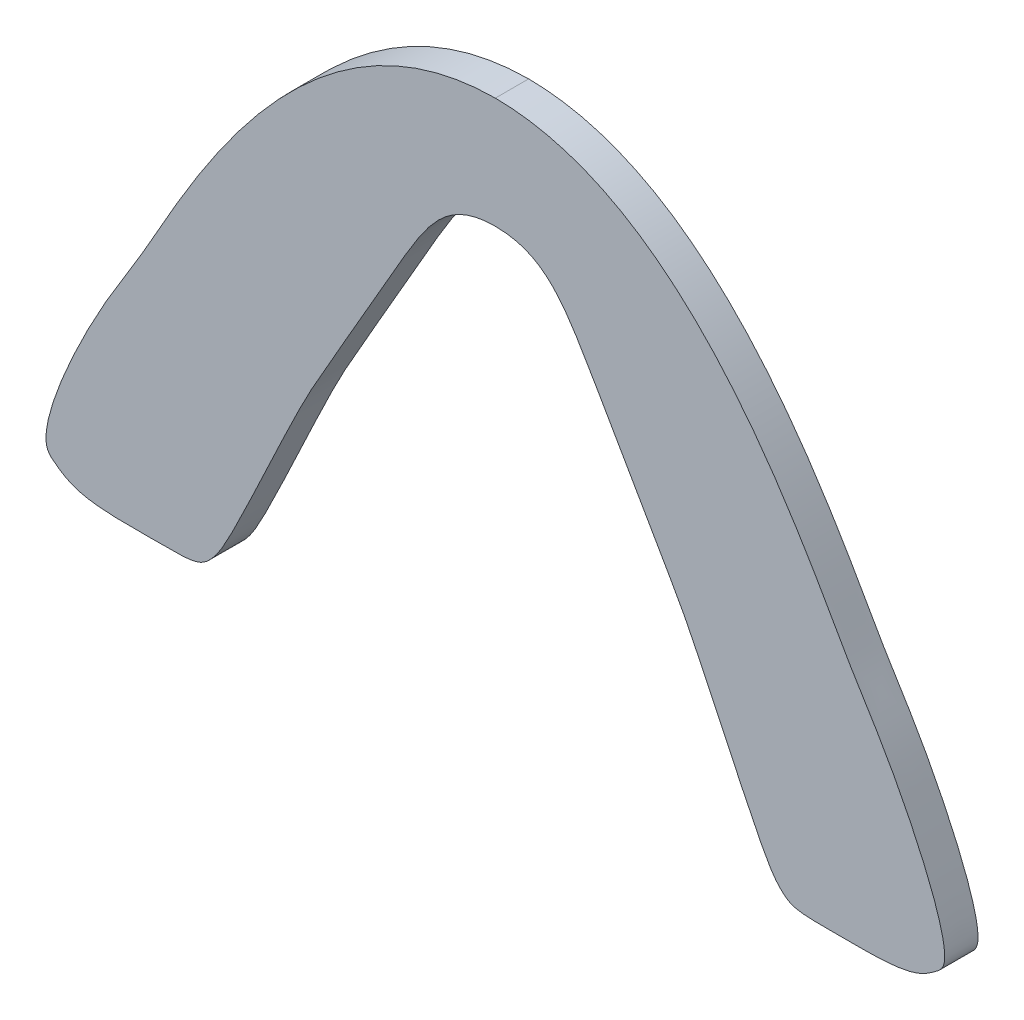
from build123d import *

# Parameters (mm, degrees)
RESSALTO_EXTRUS_O1_DEPTH = 3


with BuildPart() as part:
    # Esboço1 → Ressalto-extrusão1 (new body)
    with BuildSketch(Plane.XY):
        with BuildLine():
            add(Edge.make_bspline(
                [(0, 20), (4.383764982, 20), (7.755962794, 14.439505245), (15.41388908, 1.0206196), (18.279374485, -3.971435), (23.817696498, -16.529400627), (26.489430364, -19.939060667), (27.418970571, -19.796711745), (37.424421435, -19.856755261), (38.863004846, -18.875935677), (41.762724995, -16.714108457), (36.738190899, -5.694813236), (29.725734311, 4.938051079), (17.194279645, 29.887405842), (0, 30)],
                knots=[0.303894497, 0.303894497, 0.303894497, 0.303894497, 0.331609572, 0.357917536, 0.368722047, 0.431773278, 0.448854751, 0.522455307, 0.539221239, 0.599748136, 0.617984435, 0.70334793, 0.72300598, 0.803894497, 0.803894497, 0.803894497, 0.803894497], degree=3))
            add(Edge.make_bspline(
                [(0, 20), (-4.383764982, 20), (-7.755962794, 14.439505245), (-15.41388908, 1.0206196), (-18.279374485, -3.971435), (-23.817696498, -16.529400627), (-26.489430364, -19.939060667), (-27.418970571, -19.796711745), (-37.424421435, -19.856755261), (-38.863004846, -18.875935677), (-41.762724995, -16.714108457), (-36.738190899, -5.694813236), (-29.725734311, 4.938051079), (-17.194279645, 29.887405842), (0, 30)],
                knots=[0.303894497, 0.303894497, 0.303894497, 0.303894497, 0.331609572, 0.357917536, 0.368722047, 0.431773278, 0.448854751, 0.522455307, 0.539221239, 0.599748136, 0.617984435, 0.70334793, 0.72300598, 0.803894497, 0.803894497, 0.803894497, 0.803894497], degree=3))
        make_face()
    extrude(amount=RESSALTO_EXTRUS_O1_DEPTH)


solid = part.part
